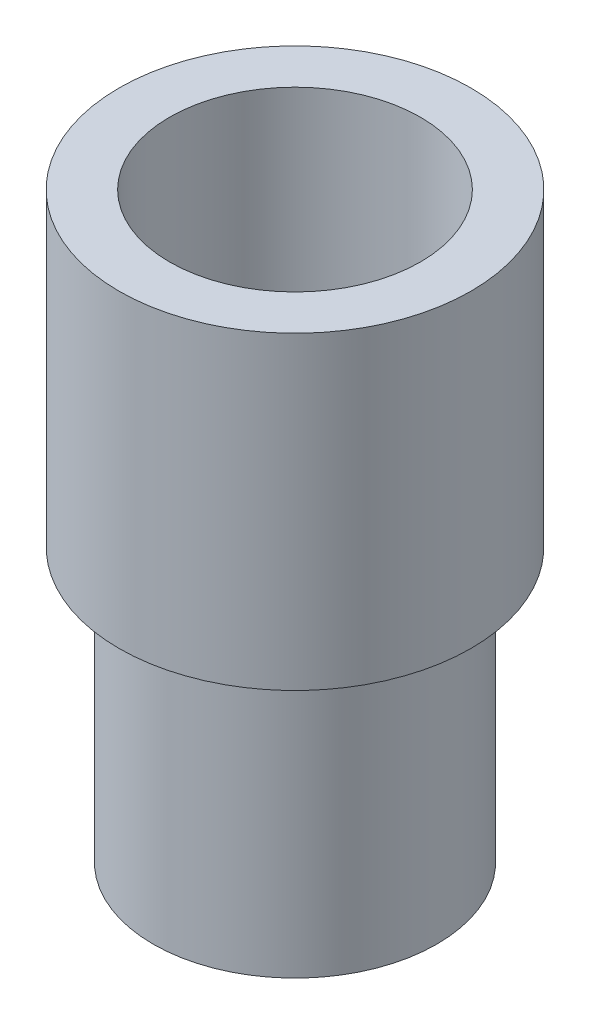
from build123d import *

# Parameters (mm, degrees)
SKETCH1_W   = 13.9954
SKETCH1_H   = 10
SKETCH1_W_2 = 1.8288
SKETCH1_H_2 = 30.48


with BuildPart() as part:
    # Sketch1 → Revolve1 (revolve)
    with BuildSketch(Plane.XY, mode=Mode.PRIVATE) as revolve1_sk:
        with Locations((6.9977, 35.48)):
            Rectangle(SKETCH1_W, SKETCH1_H)
        Polygon((13.9954, 40.48), (13.9954, 30.48), (15.8242, 30.48), (19.6342, 30.48), (19.6342, 65), (13.9954, 65), align=None)
        with Locations((14.9098, 15.24)):
            Rectangle(SKETCH1_W_2, SKETCH1_H_2)
    revolve(revolve1_sk.sketch.rotate(Axis((0, 0, 0), (0, 1, 0)), 90), axis=Axis((0, 0, 0), (0, 1, 0)))


solid = part.part
